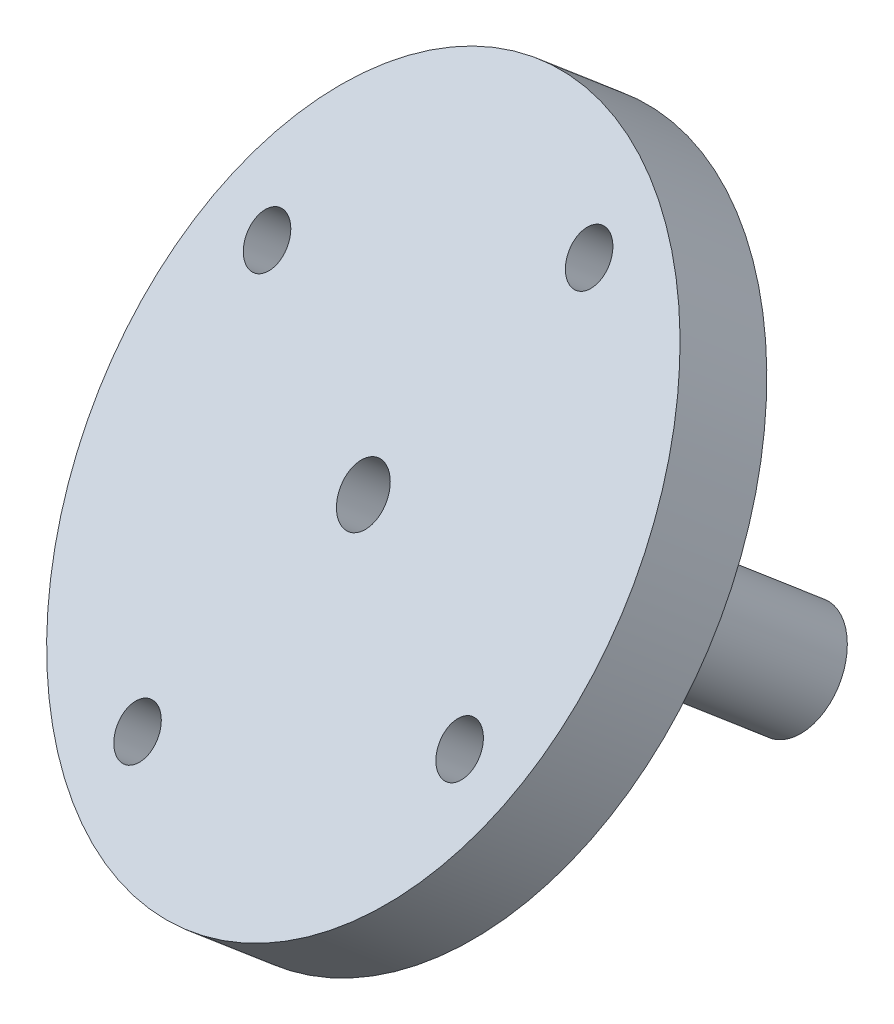
from build123d import *

# Parameters (mm, degrees)
SKETCH2_R           = 20
SKETCH2_R_2         = 1.5
SKETCH2_R_3         = 1.7
BOSS_EXTRUDE1_DEPTH = 5
SKETCH3_R           = 3.175
SKETCH3_R_2         = 1.7
BOSS_EXTRUDE2_DEPTH = 20


with BuildPart() as part:
    # Sketch2 → Boss-Extrude1 (new body)
    with BuildSketch(Plane(origin=(1017.735415605, -1937.183603399, -1858.345189311), x_dir=(0.8559741923471083, -0.18719779462757935, 0.48193896680211135), z_dir=(0.29347815464948085, -0.5914966179297112, -0.751000881305241))):
        with Locations(Location((34.01755861, 1.186625698, 0), (0, 0, 243.560182317))):
            Circle(SKETCH2_R)
        with Locations(Location((34.01755861, 16.686625698, 0), (0, 0, 243.560182317))):
            Circle(SKETCH2_R_2, mode=Mode.SUBTRACT)
        with Locations(Location((49.51755861, 1.186625698, 0), (0, 0, 243.560182317))):
            Circle(SKETCH2_R_2, mode=Mode.SUBTRACT)
        with Locations(Location((34.01755861, -14.313374302, 0), (0, 0, 243.560182317))):
            Circle(SKETCH2_R_2, mode=Mode.SUBTRACT)
        with Locations(Location((18.51755861, 1.186625698, 0), (0, 0, 243.560182317))):
            Circle(SKETCH2_R_2, mode=Mode.SUBTRACT)
        with Locations(Location((34.01755861, 1.186625698, 0), (0, 0, 243.560182317))):
            Circle(SKETCH2_R_3, mode=Mode.SUBTRACT)
    extrude(amount=BOSS_EXTRUDE1_DEPTH)

    # Sketch3 → Boss-Extrude2 (add)
    with BuildSketch(Plane(origin=(834.98630085, -1682.890413292, -2136.702299239), x_dir=(-0.2324508381951698, 0.717861154062507, -0.6562331684016045), z_dir=(0.2934781546494809, -0.5914966179297112, -0.7510008813052411))):
        with Locations(Location((-430.695128581, 121.554274761, 0), (0, 0, 14.073010208))):
            Circle(SKETCH3_R)
        with Locations(Location((-430.695128581, 121.554274761, 0), (0, 0, 14.073010208))):
            Circle(SKETCH3_R_2, mode=Mode.SUBTRACT)
    extrude(amount=BOSS_EXTRUDE2_DEPTH)


solid = part.part
